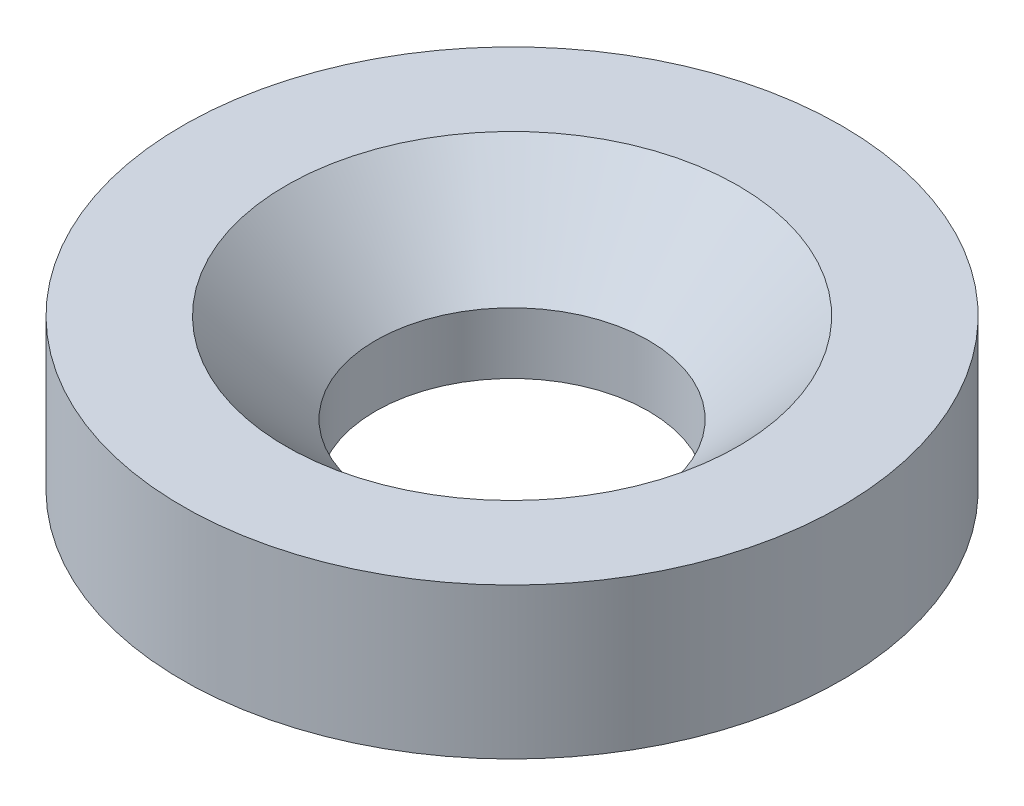
from build123d import *


with BuildPart() as part:
    # Sketch1 → Revolve1 (revolve)
    with BuildSketch(Plane.XY, mode=Mode.PRIVATE) as revolve1_sk:
        Polygon((7.25, 0), (17.5, 0), (17.5, 8), (12, 8), (7.25, 3.25), align=None)
    revolve(revolve1_sk.sketch.rotate(Axis((0, 0, 0), (0, 1, 0)), 90), axis=Axis((0, 0, 0), (0, 1, 0)))


solid = part.part
